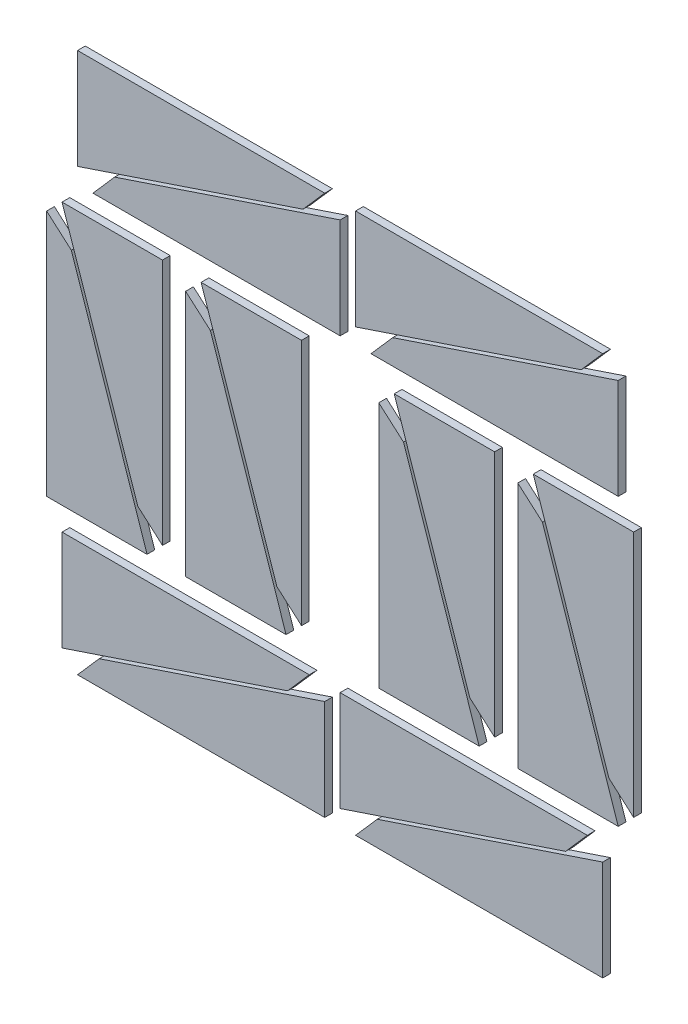
from build123d import *

# Parameters (mm, degrees)
BOSS_EXTRUDE1_DEPTH    = 1
BOSS_EXTRUDE1_2_DEPTH  = 1
BOSS_EXTRUDE1_3_DEPTH  = 1
BOSS_EXTRUDE1_4_DEPTH  = 1
BOSS_EXTRUDE1_5_DEPTH  = 1
BOSS_EXTRUDE1_6_DEPTH  = 1
BOSS_EXTRUDE1_7_DEPTH  = 1
BOSS_EXTRUDE1_8_DEPTH  = 1
BOSS_EXTRUDE1_9_DEPTH  = 1
BOSS_EXTRUDE1_10_DEPTH = 1
BOSS_EXTRUDE1_11_DEPTH = 1
BOSS_EXTRUDE1_12_DEPTH = 1
BOSS_EXTRUDE1_13_DEPTH = 1
BOSS_EXTRUDE1_14_DEPTH = 1
BOSS_EXTRUDE1_15_DEPTH = 1
BOSS_EXTRUDE1_16_DEPTH = 1


with BuildPart() as part:
    # Sketch 21 → Boss-Extrude1 (new body)
    with BuildSketch(Plane.XY):
        Polygon((45, 12), (13, 12), (15.8, 15.2), (45, 25), align=None)
    extrude(amount=BOSS_EXTRUDE1_DEPTH)


with BuildPart() as body_2:
    # Sketch 21 → Boss-Extrude1 2 (new body)
    with BuildSketch(Plane.XY):
        Polygon((11, 27), (43, 27), (40.2, 23.8), (11, 14), align=None)
    extrude(amount=BOSS_EXTRUDE1_2_DEPTH)


with BuildPart() as body_3:
    # Sketch 21 → Boss-Extrude1 3 (new body)
    with BuildSketch(Plane.XY):
        Polygon((47, 27), (79, 27), (76.2, 23.8), (47, 14), align=None)
    extrude(amount=BOSS_EXTRUDE1_3_DEPTH)


with BuildPart() as body_4:
    # Sketch 21 → Boss-Extrude1 4 (new body)
    with BuildSketch(Plane.XY):
        Polygon((81, 12), (49, 12), (51.8, 15.2), (81, 25), align=None)
    extrude(amount=BOSS_EXTRUDE1_4_DEPTH)


with BuildPart() as body_5:
    # Sketch 21 → Boss-Extrude1 5 (new body)
    with BuildSketch(Plane.XY):
        Polygon((9, 30), (9, 62), (12.2, 59.2), (22, 30), align=None)
    extrude(amount=BOSS_EXTRUDE1_5_DEPTH)


with BuildPart() as body_6:
    # Sketch 21 → Boss-Extrude1 6 (new body)
    with BuildSketch(Plane.XY):
        Polygon((24, 64), (24, 32), (20.8, 34.8), (11, 64), align=None)
    extrude(amount=BOSS_EXTRUDE1_6_DEPTH)


with BuildPart() as body_7:
    # Sketch 21 → Boss-Extrude1 7 (new body)
    with BuildSketch(Plane.XY):
        Polygon((27, 30), (27, 62), (30.2, 59.2), (40, 30), align=None)
    extrude(amount=BOSS_EXTRUDE1_7_DEPTH)


with BuildPart() as body_8:
    # Sketch 21 → Boss-Extrude1 8 (new body)
    with BuildSketch(Plane.XY):
        Polygon((42, 64), (42, 32), (38.8, 34.8), (29, 64), align=None)
    extrude(amount=BOSS_EXTRUDE1_8_DEPTH)


with BuildPart() as body_9:
    # Sketch 21 → Boss-Extrude1 9 (new body)
    with BuildSketch(Plane.XY):
        Polygon((52, 30), (52, 62), (55.2, 59.2), (65, 30), align=None)
    extrude(amount=BOSS_EXTRUDE1_9_DEPTH)


with BuildPart() as body_10:
    # Sketch 21 → Boss-Extrude1 10 (new body)
    with BuildSketch(Plane.XY):
        Polygon((67, 64), (67, 32), (63.8, 34.8), (54, 64), align=None)
    extrude(amount=BOSS_EXTRUDE1_10_DEPTH)


with BuildPart() as body_11:
    # Sketch 21 → Boss-Extrude1 11 (new body)
    with BuildSketch(Plane.XY):
        Polygon((70, 30), (70, 62), (73.2, 59.2), (83, 30), align=None)
    extrude(amount=BOSS_EXTRUDE1_11_DEPTH)


with BuildPart() as body_12:
    # Sketch 21 → Boss-Extrude1 12 (new body)
    with BuildSketch(Plane.XY):
        Polygon((85, 64), (85, 32), (81.8, 34.8), (72, 64), align=None)
    extrude(amount=BOSS_EXTRUDE1_12_DEPTH)


with BuildPart() as body_13:
    # Sketch 21 → Boss-Extrude1 13 (new body)
    with BuildSketch(Plane.XY):
        Polygon((47, 67), (15, 67), (17.8, 70.2), (47, 80), align=None)
    extrude(amount=BOSS_EXTRUDE1_13_DEPTH)


with BuildPart() as body_14:
    # Sketch 21 → Boss-Extrude1 14 (new body)
    with BuildSketch(Plane.XY):
        Polygon((13, 82), (45, 82), (42.2, 78.8), (13, 69), align=None)
    extrude(amount=BOSS_EXTRUDE1_14_DEPTH)


with BuildPart() as body_15:
    # Sketch 21 → Boss-Extrude1 15 (new body)
    with BuildSketch(Plane.XY):
        Polygon((49, 82), (81, 82), (78.2, 78.8), (49, 69), align=None)
    extrude(amount=BOSS_EXTRUDE1_15_DEPTH)


with BuildPart() as body_16:
    # Sketch 21 → Boss-Extrude1 16 (new body)
    with BuildSketch(Plane.XY):
        Polygon((83, 67), (51, 67), (53.8, 70.2), (83, 80), align=None)
    extrude(amount=BOSS_EXTRUDE1_16_DEPTH)


solid = Compound([part.part, body_2.part, body_3.part, body_4.part, body_5.part, body_6.part, body_7.part, body_8.part, body_9.part, body_10.part, body_11.part, body_12.part, body_13.part, body_14.part, body_15.part, body_16.part])
